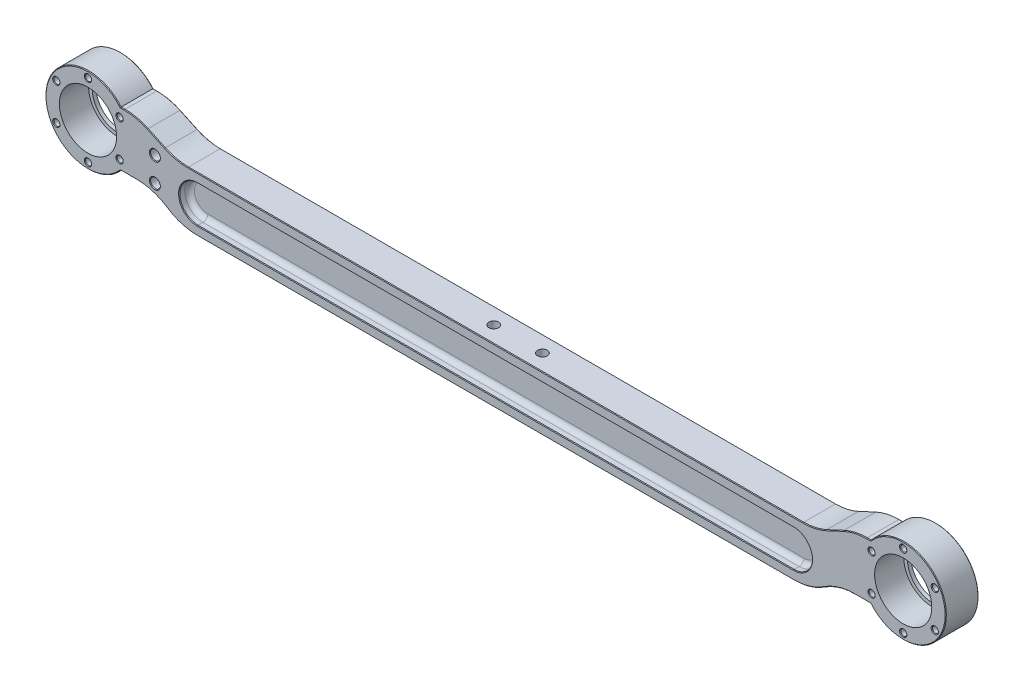
from build123d import *

# Parameters (mm, degrees)
EXTRUDE_1_DEPTH     = 13.5
CUT_EXTRUDE_1_DEPTH = 8.5
SKETCH_3_R          = 4
CUT_EXTRUDE_2_DEPTH = 15
SKETCH_6_R          = 23.5
CUT_EXTRUDE_3_DEPTH = 24
SKETCH_6_3_R        = 2.5
CUT_EXTRUDE_4_DEPTH = 15
SKETCH_6_4_R        = 20.5
CUT_EXTRUDE_5_DEPTH = 379.001653436
FILLET_1_R          = 4
SKETCH_7_R          = 4
CUT_EXTRUDE_6_DEPTH = 15
CHAMFER_1_SIZE      = 0.5


with BuildPart() as part:
    # 草图1 → 凸台-拉伸1 (new, symmetric)
    with BuildSketch(Plane.XY):
        with BuildLine():
            Line((-252.817923204, 45), (252.817923204, 45))
            ThreePointArc((252.817923204, 45), (262.557705831, 46.06667968), (271.835744982, 49.216149583))
            Line((271.835744982, 49.216149583), (285.944523165, 55.795180897))
            ThreePointArc((285.944523165, 55.795180897), (295.222562316, 58.944650801), (304.962344943, 60.01133048))
            Line((304.962344943, 60.01133048), (308.2, 60.01133048))
            ThreePointArc((308.2, 60.01133048), (369.999999218, 37.492602678), (308.190486763, 15))
            Line((308.190486763, 15), (295, 15))
            ThreePointArc((295, 15), (282.009618943, 13.084219849), (270.125314072, 7.5))
            ThreePointArc((270.125314072, 7.5), (258.241009201, 1.915780151), (245.250628145, 0))
            Line((245.250628145, 0), (-245.250628145, 0))
            ThreePointArc((-245.250628145, 0), (-258.241009201, 1.915780151), (-270.125314072, 7.5))
            ThreePointArc((-270.125314072, 7.5), (-282.009618943, 13.084219849), (-295, 15))
            Line((-295, 15), (-308.190486763, 15))
            ThreePointArc((-308.190486763, 15), (-369.999999218, 37.492602678), (-308.2, 60.01133048))
            Line((-308.2, 60.01133048), (-304.962344943, 60.01133048))
            ThreePointArc((-304.962344943, 60.01133048), (-295.222562316, 58.944650801), (-285.944523165, 55.795180897))
            Line((-285.944523165, 55.795180897), (-271.835744982, 49.216149583))
            ThreePointArc((-271.835744982, 49.216149583), (-262.557705831, 46.06667968), (-252.817923204, 45))
        make_face()
    extrude(amount=EXTRUDE_1_DEPTH, both=True)

    # 草图2 → 切除-拉伸1 (cut)
    with BuildSketch(Plane.XY.offset(13.5)):
        with BuildLine():
            Line((-245, 37.5), (245, 37.5))
            ThreePointArc((245, 37.5), (260, 22.5), (245, 7.5))
            Line((245, 7.5), (-245, 7.5))
            ThreePointArc((-245, 7.5), (-260, 22.5), (-245, 37.5))
        make_face()
    cut_extrude_1 = extrude(amount=-CUT_EXTRUDE_1_DEPTH, mode=Mode.SUBTRACT)

    # 镜向1: 切除-拉伸1 across plane
    add(cut_extrude_1.mirror(Plane.XY), mode=Mode.SUBTRACT)

    # 草图3 → 切除-拉伸2 (cut)
    with BuildSketch(Plane(origin=(0, 45, 0), x_dir=(1, 0, 0), z_dir=(0, 1, 0))):
        with Locations((-15, 0)):
            Circle(SKETCH_3_R)
        with Locations((25, 0)):
            Circle(SKETCH_3_R)
    extrude(amount=-CUT_EXTRUDE_2_DEPTH, mode=Mode.SUBTRACT)

    # 草图6 → 切除-拉伸3 (cut)
    with BuildSketch(Plane.XY.offset(13.5)):
        with Locations((335, 37.5)):
            Circle(SKETCH_6_R)
        with Locations((-335, 37.5)):
            Circle(SKETCH_6_R)
    extrude(amount=-CUT_EXTRUDE_3_DEPTH, mode=Mode.SUBTRACT)

    # 草图6<3> → 切除-拉伸4 (cut)
    with BuildSketch(Plane.XY.offset(13.5)):
        with Locations((335, 67.5)):
            Circle(SKETCH_6_3_R)
        with Locations((360.980762114, 52.5)):
            Circle(SKETCH_6_3_R)
        with Locations((360.980762114, 22.5)):
            Circle(SKETCH_6_3_R)
        with Locations((335, 7.5)):
            Circle(SKETCH_6_3_R)
        with Locations((309.019237886, 22.5)):
            Circle(SKETCH_6_3_R)
        with Locations((309.019237886, 52.5)):
            Circle(SKETCH_6_3_R)
        with Locations((-309.019237886, 52.5)):
            Circle(SKETCH_6_3_R)
        with Locations((-309.019237886, 22.5)):
            Circle(SKETCH_6_3_R)
        with Locations((-335, 7.5)):
            Circle(SKETCH_6_3_R)
        with Locations((-360.980762114, 22.5)):
            Circle(SKETCH_6_3_R)
        with Locations((-360.980762114, 52.5)):
            Circle(SKETCH_6_3_R)
        with Locations((-335, 67.5)):
            Circle(SKETCH_6_3_R)
    extrude(amount=-CUT_EXTRUDE_4_DEPTH, mode=Mode.SUBTRACT)

    # 草图6<4> → 切除-拉伸5 (cut, through all)
    with BuildSketch(Plane.XY.offset(13.5)):
        with Locations((335, 37.5)):
            Circle(SKETCH_6_4_R)
        with Locations((-335, 37.5)):
            Circle(SKETCH_6_4_R)
    extrude(amount=-CUT_EXTRUDE_5_DEPTH, mode=Mode.SUBTRACT)

    # 圆角1
    fillet_1_edges = [part.edges().sort_by_distance(p)[0] for p in [
        (260, 22.5, -5),
        (0, 7.5, -5),
        (-260, 22.5, -5),
        (-260, 22.5, 5),
        (0, 37.5, 5),
        (260, 22.5, 5),
        (0, 37.5, -5),
        (0, 7.5, 5),
    ]]
    fillet(fillet_1_edges, radius=FILLET_1_R)

    # 草图7 → 切除-拉伸6 (cut)
    with BuildSketch(Plane.XY.offset(13.5)):
        with Locations((-280, 40)):
            Circle(SKETCH_7_R)
        with Locations((-280, 20)):
            Circle(SKETCH_7_R)
    extrude(amount=-CUT_EXTRUDE_6_DEPTH, mode=Mode.SUBTRACT)

    # 倒角1
    chamfer_1_edges = [part.edges().sort_by_distance(p)[0] for p in [
        (0, 37.5, -13.5),
        (260, 22.5, -13.5),
        (0, 7.5, -13.5),
        (-260, 22.5, -13.5),
        (0, 45, -13.5),
        (-262.557705831, 46.06667968, -13.5),
        (-278.890134073, 52.50566524, -13.5),
        (-295.222562316, 58.944650801, -13.5),
        (-306.581172471, 60.01133048, -13.5),
        (-369.999999218, 37.492602678, -13.5),
        (-301.595243382, 15, -13.5),
        (-282.009618943, 13.084219849, -13.5),
        (-258.241009201, 1.915780151, -13.5),
        (0, 0, -13.5),
        (258.241009201, 1.915780151, -13.5),
        (282.009618943, 13.084219849, -13.5),
        (301.595243382, 15, -13.5),
        (369.999999218, 37.492602678, -13.5),
        (306.581172471, 60.01133048, -13.5),
        (295.222562316, 58.944650801, -13.5),
        (278.890134073, 52.50566524, -13.5),
        (262.557705831, 46.06667968, -13.5),
        (306.519237886, 22.5, 13.5),
        (306.519237886, 52.5, 13.5),
        (332.5, 67.5, 13.5),
        (332.5, 7.5, 13.5),
        (358.480762114, 22.5, 13.5),
        (358.480762114, 52.5, 13.5),
        (278.890134073, 52.50566524, 13.5),
        (295.222562316, 58.944650801, 13.5),
        (306.581172471, 60.01133048, 13.5),
        (369.999999218, 37.492602678, 13.5),
        (301.595243382, 15, 13.5),
        (282.009618943, 13.084219849, 13.5),
        (258.241009201, 1.915780151, 13.5),
        (0, 0, 13.5),
        (-258.241009201, 1.915780151, 13.5),
        (-282.009618943, 13.084219849, 13.5),
        (-301.595243382, 15, 13.5),
        (-369.999999218, 37.492602678, 13.5),
        (-306.581172471, 60.01133048, 13.5),
        (-295.222562316, 58.944650801, 13.5),
        (-278.890134073, 52.50566524, 13.5),
        (-262.557705831, 46.06667968, 13.5),
        (0, 45, 13.5),
        (262.557705831, 46.06667968, 13.5),
        (0, 7.5, 13.5),
        (260, 22.5, 13.5),
        (0, 37.5, 13.5),
        (-260, 22.5, 13.5),
        (-337.5, 7.5, 13.5),
        (-311.519237886, 22.5, 13.5),
        (-311.519237886, 52.5, 13.5),
        (-363.480762114, 22.5, 13.5),
        (-363.480762114, 52.5, 13.5),
        (-337.5, 67.5, 13.5),
        (-284, 20, 13.5),
        (-284, 40, 13.5),
        (332.5, 7.5, -1.5),
        (358.480762114, 22.5, -1.5),
        (358.480762114, 52.5, -1.5),
    ]]
    chamfer(chamfer_1_edges, length=CHAMFER_1_SIZE)


solid = part.part
